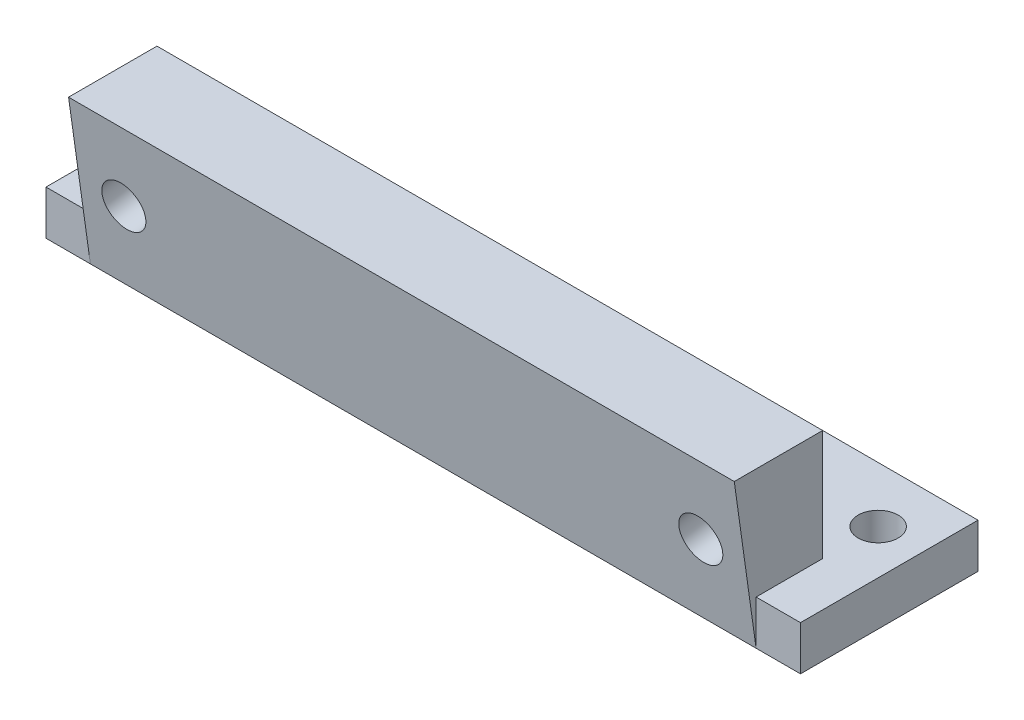
from build123d import *

# Parameters (mm, degrees)
SKETCH2_W           = 43.18
SKETCH2_H           = 10.16
BOSS_EXTRUDE1_DEPTH = 2.54
SKETCH3_W           = 38.1
SKETCH3_H           = 3.81
BOSS_EXTRUDE2_DEPTH = 6.35
SKETCH4_R           = 1.143
CUT_EXTRUDE1_DEPTH  = 24.070695698
BOSS_EXTRUDE3_DEPTH = 38.1
SKETCH6_R           = 1.25
CUT_EXTRUDE2_DEPTH  = 26.677507073


with BuildPart() as part:
    # Sketch2 → Boss-Extrude1 (new body)
    with BuildSketch(Plane(origin=(0, 0, 0), x_dir=(1, 0, 0), z_dir=(0, 1, 0))):
        Rectangle(SKETCH2_W, SKETCH2_H)
    extrude(amount=BOSS_EXTRUDE1_DEPTH)

    # Sketch3 → Boss-Extrude2 (add)
    with BuildSketch(Plane(origin=(0, 2.54, 0), x_dir=(1, 0, 0), z_dir=(0, 1, 0))):
        with Locations((0, -3.175)):
            Rectangle(SKETCH3_W, SKETCH3_H)
    extrude(amount=BOSS_EXTRUDE2_DEPTH)

    # Sketch4 → Cut-Extrude1 (cut, through all)
    with BuildSketch(Plane(origin=(0, 2.54, 0), x_dir=(1, 0, 0), z_dir=(0, 1, 0))):
        with Locations(Location((19.05, 1.905, 0), (0, 0, 270))):
            Circle(SKETCH4_R)
        with Locations(Location((-19.05, 1.905, 0), (0, 0, 270))):
            Circle(SKETCH4_R)
    extrude(amount=-CUT_EXTRUDE1_DEPTH, mode=Mode.SUBTRACT)

    # Sketch5 → Boss-Extrude3 (add)
    with BuildSketch(Plane.ZY.offset(19.05)):
        Polygon((5.08, 8.89), (6.329408021, 8.89), (5.08, 0), align=None)
    extrude(amount=-BOSS_EXTRUDE3_DEPTH)

    # Sketch6 → Cut-Extrude2 (cut, through all)
    with BuildSketch(Plane(origin=(0, -0.700118884, 4.981604708), x_dir=(1, 0, 0), z_dir=(0, -0.1391731009600584, 0.9902680687415715))):
        with Locations(Location((-16.51, 5.195682913, 0), (0, 0, 270))):
            Circle(SKETCH6_R)
        with Locations(Location((16.51, 5.195682913, 0), (0, 0, 270))):
            Circle(SKETCH6_R)
    extrude(amount=-CUT_EXTRUDE2_DEPTH, mode=Mode.SUBTRACT)


solid = part.part
